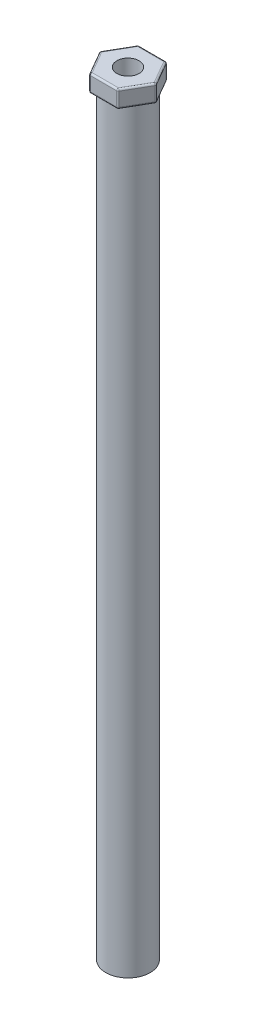
from build123d import *

# Parameters (mm, degrees)
SKETCH1_R           = 6.35
SKETCH1_R_2         = 3.175
BOSS_EXTRUDE1_DEPTH = 215.9
SKETCH2_R           = 3.175
BOSS_EXTRUDE2_DEPTH = 5
FILLET1_R           = 0.5


with BuildPart() as part:
    # Sketch1 → Boss-Extrude1 (new body)
    with BuildSketch(Plane(origin=(0, 0, 0), x_dir=(1, 0, 0), z_dir=(0, 1, 0))):
        with Locations(Location((0, 0, 0), (0, 0, 90))):
            Circle(SKETCH1_R)
        with Locations(Location((0, 0, 0), (0, 0, 90))):
            Circle(SKETCH1_R_2, mode=Mode.SUBTRACT)
    extrude(amount=BOSS_EXTRUDE1_DEPTH)

    # Sketch2 → Boss-Extrude2 (add)
    with BuildSketch(Plane(origin=(0, 215.9, 0), x_dir=(1, 0, 0), z_dir=(0, 1, 0))):
        Polygon((-8.065583261, 0), (-4.03279163, -6.985), (4.03279163, -6.985), (8.065583261, 0), (4.03279163, 6.985), (-4.03279163, 6.985), align=None)
        with Locations(Location((0, 0, 0), (0, 0, 90))):
            Circle(SKETCH2_R, mode=Mode.SUBTRACT)
    extrude(amount=BOSS_EXTRUDE2_DEPTH)

    # Fillet1
    fillet1_edges = [part.edges().sort_by_distance(p)[0] for p in [
        (-6.049187445, 220.9, -3.4925),
        (-6.049187445, 220.9, 3.4925),
        (0, 220.9, 6.985),
        (6.049187445, 220.9, 3.4925),
        (6.049187445, 220.9, -3.4925),
        (0, 220.9, -6.985),
        (-6.049187445, 215.9, -3.4925),
        (-4.03279163, 218.4, -6.985),
        (-6.049187445, 215.9, 3.4925),
        (-8.065583261, 218.4, 0),
        (0, 215.9, 6.985),
        (-4.03279163, 218.4, 6.985),
        (6.049187445, 215.9, 3.4925),
        (4.03279163, 218.4, 6.985),
        (6.049187445, 215.9, -3.4925),
        (8.065583261, 218.4, 0),
        (0, 215.9, -6.985),
        (4.03279163, 218.4, -6.985),
    ]]
    fillet(fillet1_edges, radius=FILLET1_R)


solid = part.part
